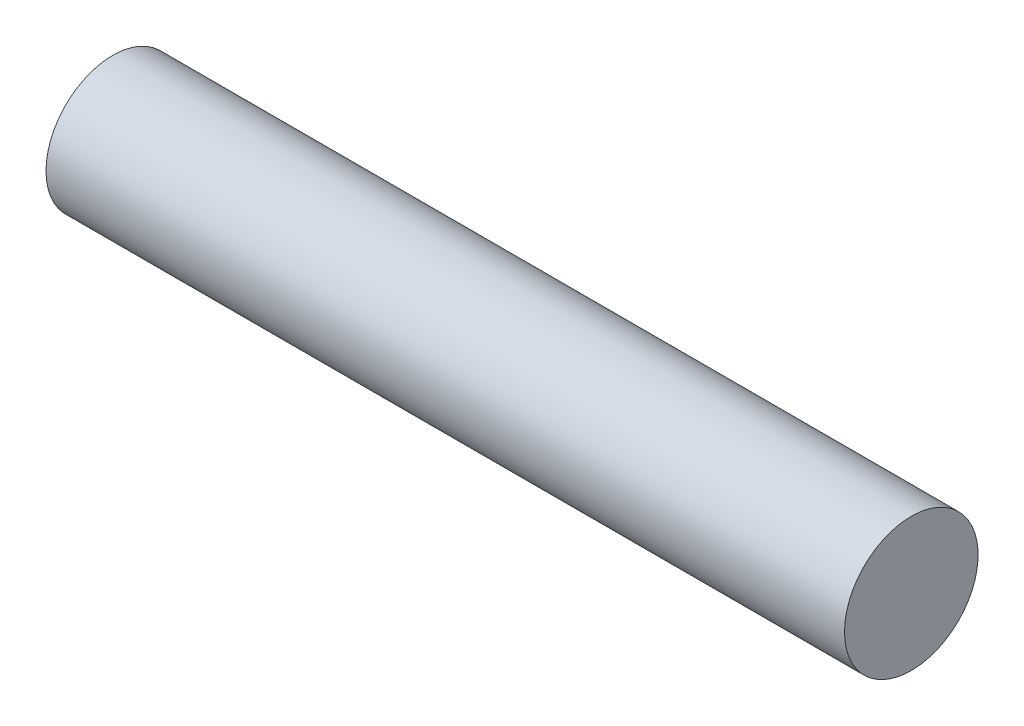
from build123d import *

# Parameters (mm, degrees)
SKETCH1_R           = 5.08
BOSS_EXTRUDE2_DEPTH = 60.706


with BuildPart() as part:
    # Sketch1 → Boss-Extrude2 (new body)
    with BuildSketch(Plane(origin=(0, 0, 0), x_dir=(0, 0, -1), z_dir=(1, 0, 0))):
        with Locations(Location((-40.508342014, -0.810898936, 0), (0, 0, 180))):
            Circle(SKETCH1_R)
    extrude(amount=BOSS_EXTRUDE2_DEPTH)


solid = part.part
